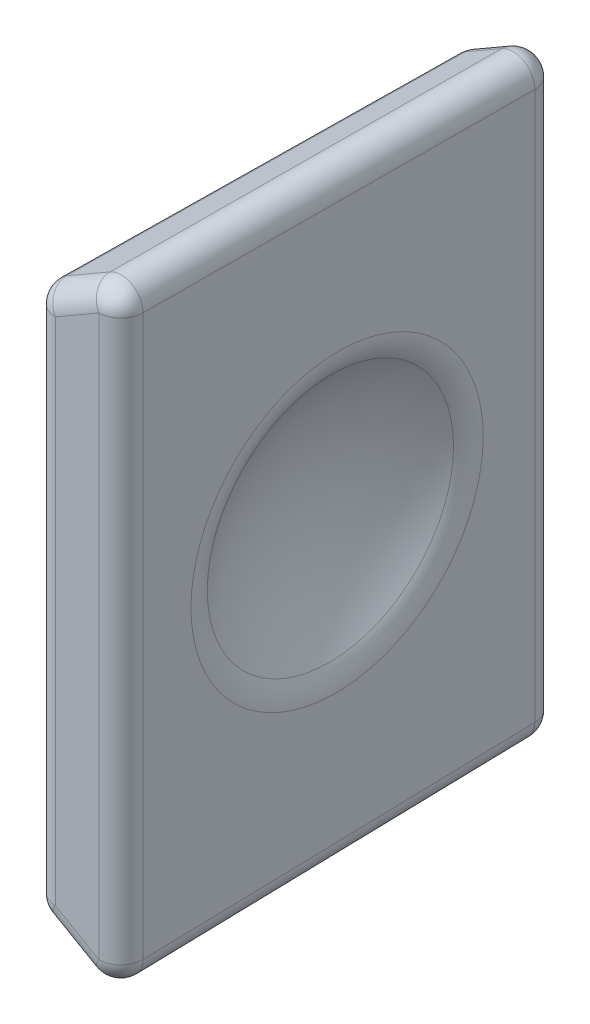
from build123d import *

# Parameters (mm, degrees)
BOSS_EXTRUDE1_DEPTH = 20
BOSS_EXTRUDE1_DRAFT = -0.5
FILLET1_R           = 1
FILLET2_R           = 2


with BuildPart() as part:
    # Sketch1 → Boss-Extrude1 (with draft: the straight prism first)
    with BuildSketch(Plane.XY):
        Polygon((-4, 12.190598923), (-4, -12.190598923), (0, -14.5), (0, 14.5), align=None)
    extrude(amount=-BOSS_EXTRUDE1_DEPTH)
    # Boss-Extrude1: the draft: its side faces are tilted about the plane it starts from
    boss_extrude1_sides = [part.faces().sort_by_distance(p)[0] for p in [
        (-4, 0, -10),
        (-2, -13.345299462, -10),
        (0, 0, -10),
        (-2, 13.345299462, -10),
    ]]
    draft(boss_extrude1_sides, Plane.XY, BOSS_EXTRUDE1_DRAFT)

    # Fillet1
    fillet1_edges = [part.edges().sort_by_distance(p)[0] for p in [
        (-2, 13.143761083, -20),
        (-3.825462644, 0, -20),
        (-2, -13.143761083, -20),
        (-4, 0, 0),
        (-2, 13.345299462, 0),
        (0, 0, 0),
        (-2, -13.345299462, 0),
        (-3.912731322, -12.140214329, -10),
        (-3.912731322, 12.140214329, -10),
        (-0.087268678, 14.348846216, -10),
        (-0.087268678, -14.348846216, -10),
        (-0.174537356, 0, -20),
    ]]
    fillet(fillet1_edges, radius=FILLET1_R)

    # Sketch2 → Cut-Revolve1 (revolve, cut)
    with BuildSketch(Plane(origin=(0, 0, 0), x_dir=(1, 0, 0), z_dir=(0, 1, 0))):
        with BuildLine():
            Line((8.726833455, 10.000724303), (8.726833455, -0.726109151))
            ThreePointArc((8.726833455, -0.726109151), (16.311850131, 2.415707627), (19.453666909, 10.000724303))
            ThreePointArc((19.453666909, 10.000724303), (16.311850131, 17.58574098), (8.726833455, 20.727557758))
            Line((8.726833455, 20.727557758), (8.726833455, 10.000724303))
        make_face()
    revolve(axis=Axis((8.726833455, 0, -20.727557758), (0, 0, 1)), mode=Mode.SUBTRACT)

    # Fillet2
    fillet2_edges = [part.edges().sort_by_distance(p)[0] for p in [
        (-0.139958798, 0, -16.037689693),
    ]]
    fillet(fillet2_edges, radius=FILLET2_R)


solid = part.part
